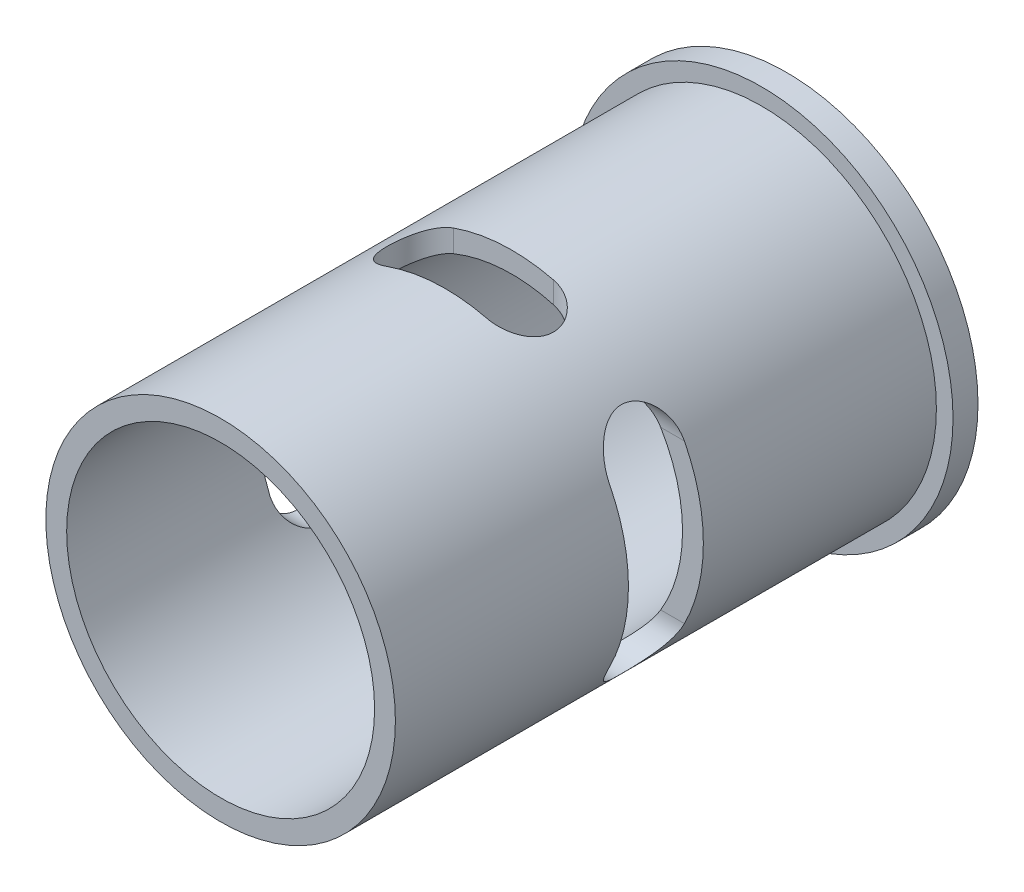
from build123d import *

# Parameters (mm, degrees)
ESQUISSE1_R             = 10.5
BASE_EXTRUSION_DEPTH    = 32.5
ESQUISSE3_R             = 11.5
BOSS_EXTRU_1_DEPTH      = 1.5
ESQUISSE2_R             = 9.25
ENL_V_MAT_EXTRU_1_DEPTH = 38.68952109
ENL_V_MAT_EXTRU_2_REACH = 42.896
ENL_V_MAT_EXTRU_3_DEPTH = 41.896210173
ENL_V_MAT_EXTRU_5_REACH = 43.167


with BuildPart() as part:
    # Esquisse1 → Base-Extrusion (new body)
    with BuildSketch(Plane.XY):
        Circle(ESQUISSE1_R)
    extrude(amount=BASE_EXTRUSION_DEPTH)

    # Esquisse3 → Boss.-Extru.1 (add)
    with BuildSketch(Plane(origin=(0, 0, 0), x_dir=(-1, 0, 0), z_dir=(0, 0, -1))):
        Circle(ESQUISSE3_R)
    extrude(amount=BOSS_EXTRU_1_DEPTH)

    # Esquisse2 → Enlèv. mat.-Extru.1 (cut, through all)
    with BuildSketch(Plane.XY.offset(32.5)):
        Circle(ESQUISSE2_R)
    extrude(amount=-ENL_V_MAT_EXTRU_1_DEPTH, mode=Mode.SUBTRACT)

    # Esquisse4 → Enlèv. mat.-Extru.2 (cut, up to next)
    with BuildSketch(Plane(origin=(10.5, 0, 0), x_dir=(0, 0, -1), z_dir=(1, 0, 0)), mode=Mode.PRIVATE) as enl_v_mat_extru_2_sk1:
        with BuildLine():
            Line((-14, 4.75), (-14, -4.75))
            ThreePointArc((-14, -4.75), (-16.25, -7), (-18.5, -4.75))
            Line((-18.5, -4.75), (-18.5, 4.75))
            ThreePointArc((-18.5, 4.75), (-16.25, 7), (-14, 4.75))
        make_face()
    enl_v_mat_extru_2_tool1 = extrude(enl_v_mat_extru_2_sk1.sketch, amount=-ENL_V_MAT_EXTRU_2_REACH, mode=Mode.PRIVATE) & part.part
    add(enl_v_mat_extru_2_tool1.solids().sort_by_distance((10.5, 0, 16.25))[0], mode=Mode.SUBTRACT)

    # Esquisse5 → Enlèv. mat.-Extru.3 (cut, through all)
    with BuildSketch(Plane(origin=(0, 10.5, 0), x_dir=(-1, 0, 0), z_dir=(0, 1, 0))):
        with BuildLine():
            Line((3.5, 19), (-2.5, 19))
            ThreePointArc((-2.5, 19), (-4.5, 17), (-2.5, 15))
            Line((-2.5, 15), (3.5, 15))
            ThreePointArc((3.5, 15), (5.5, 17), (3.5, 19))
        make_face()
    extrude(amount=-ENL_V_MAT_EXTRU_3_DEPTH, mode=Mode.SUBTRACT)

    # Esquisse7 → Enlèv. mat.-Extru.5 (cut, up to next)
    with BuildSketch(Plane(origin=(-11, 0, 0), x_dir=(0, 0, -1), z_dir=(1, 0, 0)), mode=Mode.PRIVATE) as enl_v_mat_extru_5_sk1:
        with BuildLine():
            Line((-17, -3.5), (-17, 3.5))
            ThreePointArc((-17, 3.5), (-19, 5.5), (-21, 3.5))
            Line((-21, 3.5), (-21, -3.5))
            ThreePointArc((-21, -3.5), (-19, -5.5), (-17, -3.5))
        make_face()
    enl_v_mat_extru_5_tool1 = extrude(enl_v_mat_extru_5_sk1.sketch, amount=ENL_V_MAT_EXTRU_5_REACH, mode=Mode.PRIVATE) & part.part
    add(enl_v_mat_extru_5_tool1.solids().sort_by_distance((-11, 0, 19))[0], mode=Mode.SUBTRACT)


solid = part.part
